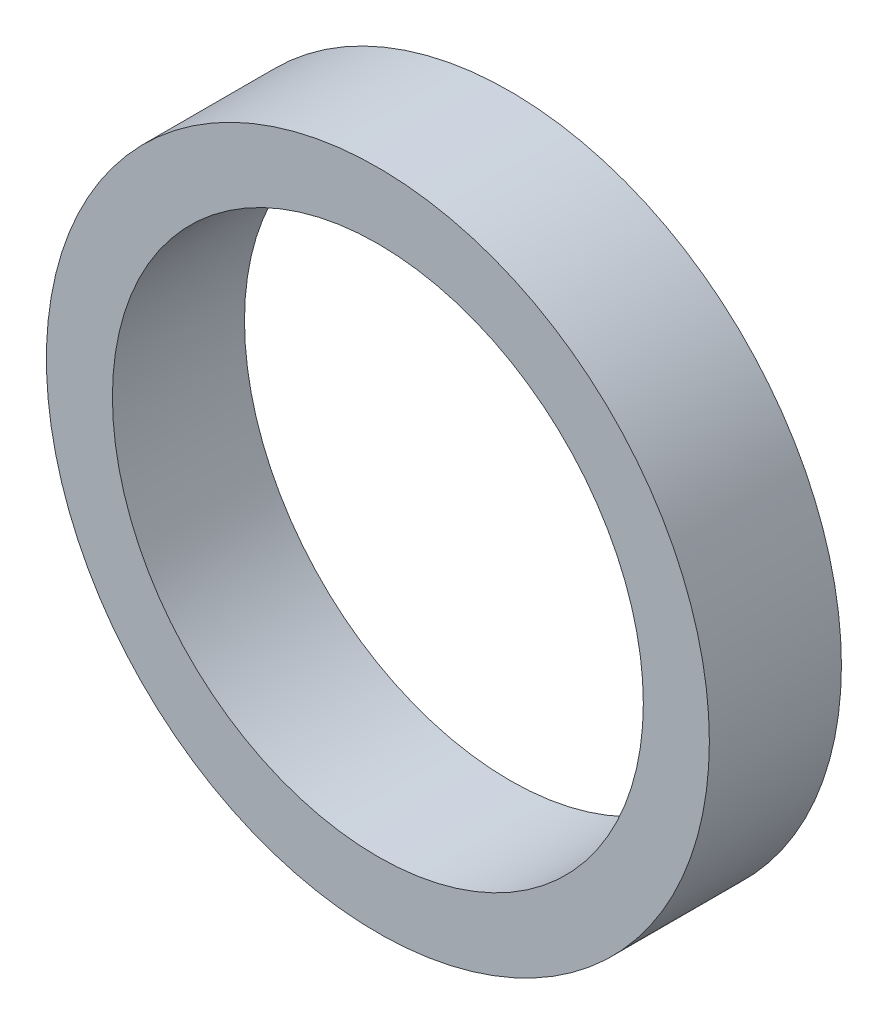
from build123d import *

# Parameters (mm, degrees)
SKETCH_1_R          = 12.55
EXTRUDE_1_DEPTH     = 5
SKETCH_2_R          = 10.05
CUT_EXTRUDE_1_DEPTH = 5


with BuildPart() as part:
    # 草图1 → 凸台-拉伸1 (new body)
    with BuildSketch(Plane.XY):
        Circle(SKETCH_1_R)
    extrude(amount=EXTRUDE_1_DEPTH)

    # 草图2 → 切除-拉伸1 (cut)
    with BuildSketch(Plane(origin=(0, 0, 0), x_dir=(-1, 0, 0), z_dir=(0, 0, -1))):
        Circle(SKETCH_2_R)
    extrude(amount=-CUT_EXTRUDE_1_DEPTH, mode=Mode.SUBTRACT)


solid = part.part
